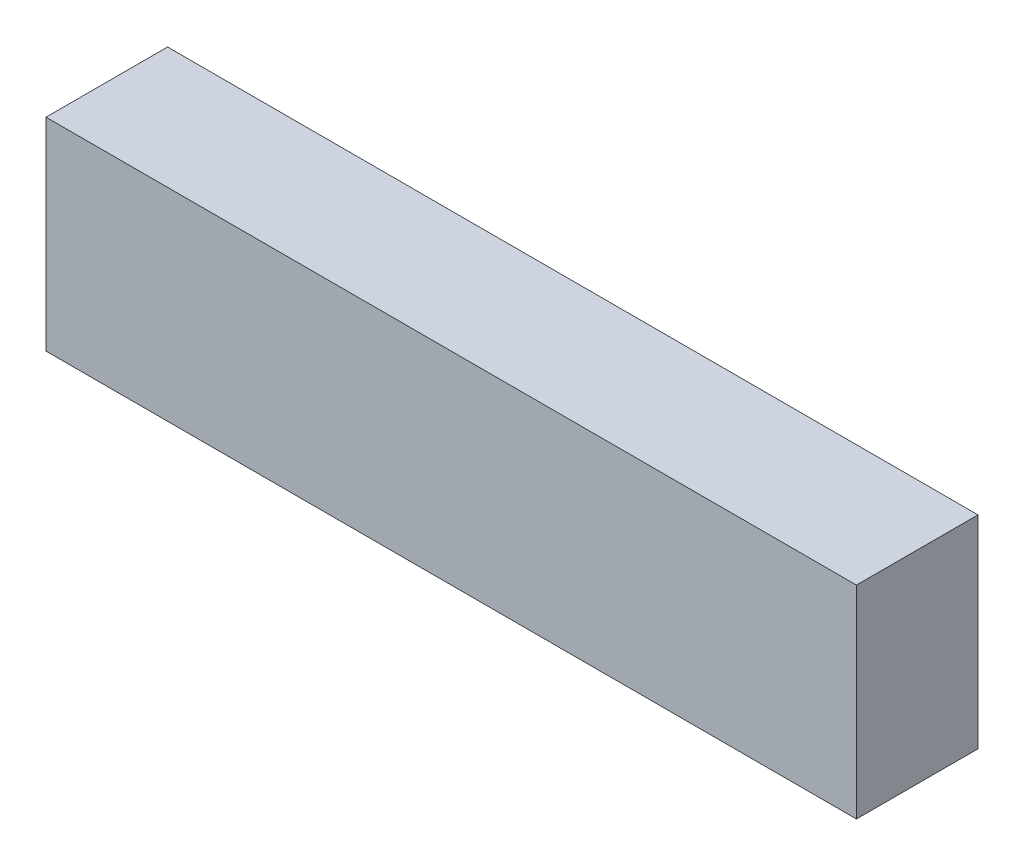
from build123d import *

# Parameters (mm, degrees)
SKETCH1_W           = 20
SKETCH1_H           = 5
BOSS_EXTRUDE1_DEPTH = 3


with BuildPart() as part:
    # Sketch1 → Boss-Extrude1 (new body)
    with BuildSketch(Plane.XY):
        Rectangle(SKETCH1_W, SKETCH1_H)
    extrude(amount=BOSS_EXTRUDE1_DEPTH)


solid = part.part
